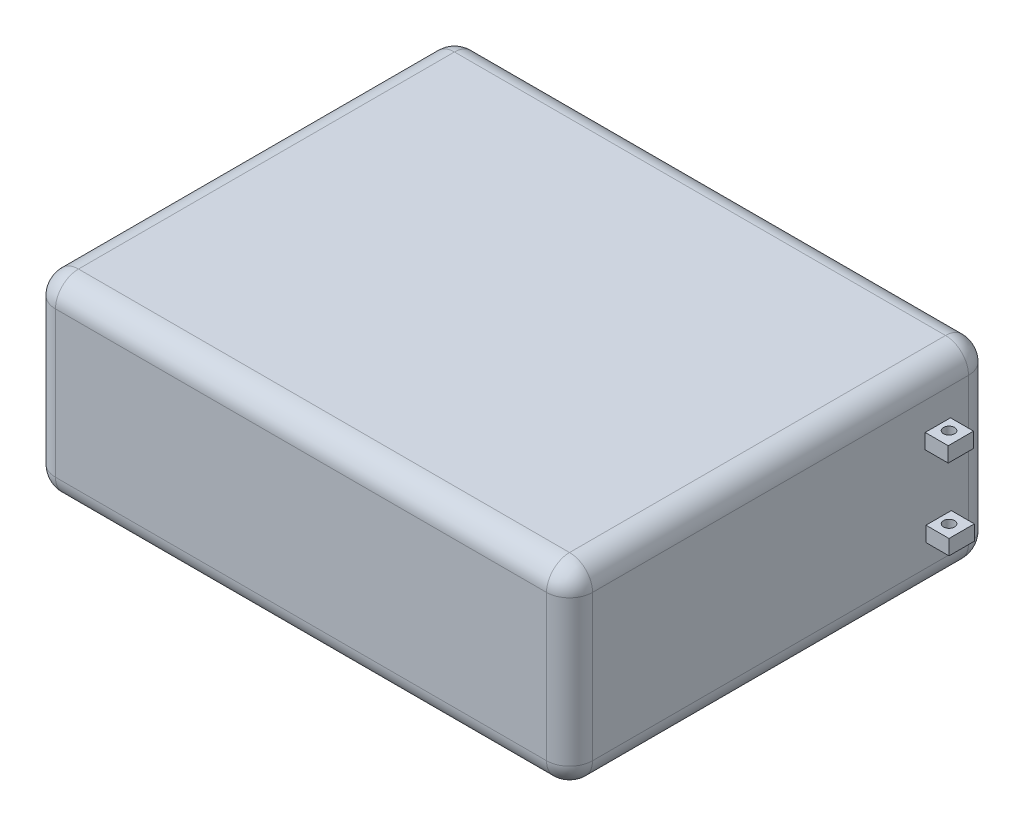
from build123d import *

# Parameters (mm, degrees)
SKETCH1_W           = 70
SKETCH1_H           = 55
BOSS_EXTRUDE1_DEPTH = 25
FILLET1_R           = 3
SKETCH2_W           = 3.300925217
SKETCH2_H           = 1.959924347
BOSS_EXTRUDE2_DEPTH = 3
SKETCH3_R           = 0.719628756
CUT_EXTRUDE1_DEPTH  = 22


with BuildPart() as part:
    # Sketch1 → Boss-Extrude1 (new body)
    with BuildSketch(Plane(origin=(0, 0, 0), x_dir=(1, 0, 0), z_dir=(0, 1, 0))):
        Rectangle(SKETCH1_W, SKETCH1_H)
    extrude(amount=BOSS_EXTRUDE1_DEPTH)

    # Fillet1
    fillet1_edges = [part.edges().sort_by_distance(p)[0] for p in [
        (-35, 25, 0),
        (0, 25, 27.5),
        (35, 25, 0),
        (0, 0, 27.5),
        (-35, 0, 0),
        (0, 0, -27.5),
        (35, 0, 0),
        (35, 12.5, 27.5),
        (-35, 12.5, 27.5),
        (-35, 12.5, -27.5),
        (35, 12.5, -27.5),
        (0, 25, -27.5),
    ]]
    fillet(fillet1_edges, radius=FILLET1_R)

    # Sketch2 → Boss-Extrude2 (add)
    with BuildSketch(Plane(origin=(35, 0, 0), x_dir=(0, 0, -1), z_dir=(1, 0, 0))):
        with Locations((20.501840212, 17.399810869)):
            Rectangle(SKETCH2_W, SKETCH2_H)
        with Locations((20.604994125, 6.87811174)):
            Rectangle(SKETCH2_W, SKETCH2_H)
    extrude(amount=BOSS_EXTRUDE2_DEPTH)

    # Sketch3 → Cut-Extrude1 (cut)
    with BuildSketch(Plane(origin=(0, 18.379773042, 0), x_dir=(1, 0, 0), z_dir=(0, 1, 0))):
        with Locations(Location((36.345846873, 20.613426823, 0), (0, 0, 270))):
            Circle(SKETCH3_R)
    extrude(amount=-CUT_EXTRUDE1_DEPTH, mode=Mode.SUBTRACT)


solid = part.part
